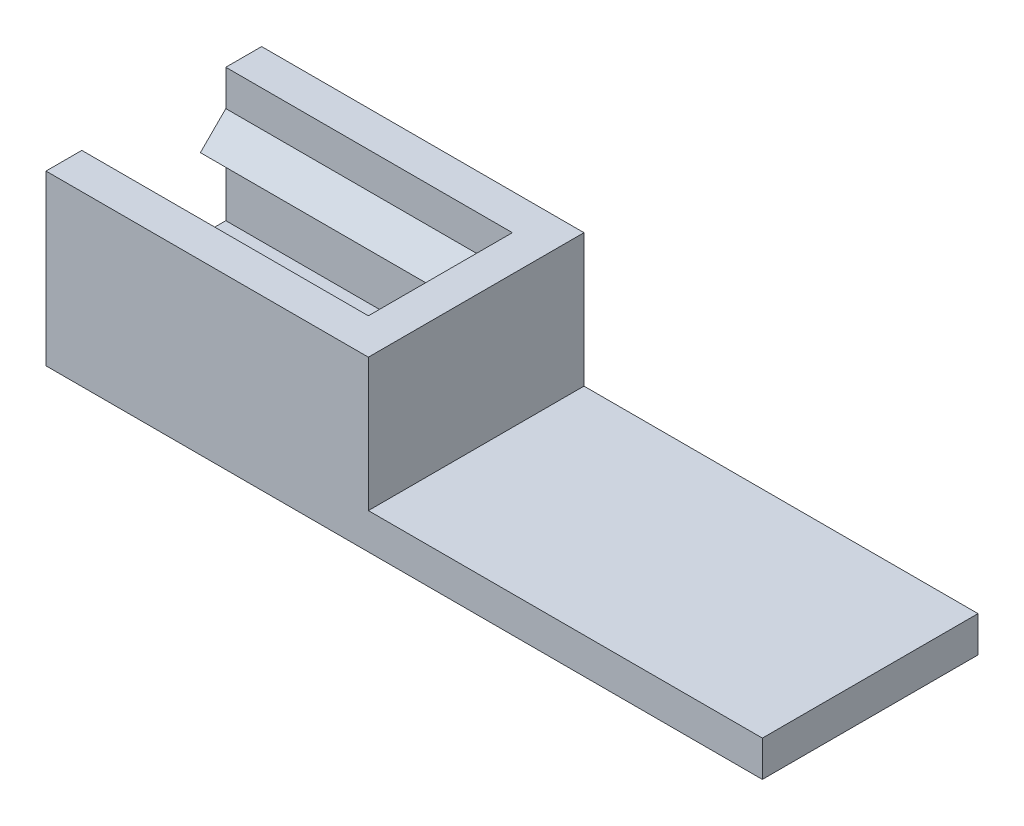
from build123d import *

# Parameters (mm, degrees)
BOSS_EXTRUDE1_DEPTH = 20
SKETCH3_W           = 30.1
SKETCH3_H           = 5
BOSS_EXTRUDE2_DEPTH = 60
SKETCH4_W           = 5
SKETCH4_H           = 30.1
BOSS_EXTRUDE3_DEPTH = 18.55


with BuildPart() as part:
    # Sketch2 → Boss-Extrude1 (new, symmetric)
    with BuildSketch(Plane(origin=(0, 0, 0), x_dir=(0, 0, -1), z_dir=(1, 0, 0))):
        Polygon((15.05, 0), (-15.05, 0), (-15.05, 23.55), (-10.05, 23.55), (-10.05, 18.55), (-6.5, 15), (-10.05, 11.45), (-10.05, 5), (10.05, 5), (10.05, 11.45), (6.5, 15), (10.05, 18.55), (10.05, 23.55), (15.05, 23.55), align=None)
    extrude(amount=BOSS_EXTRUDE1_DEPTH, both=True)

    # Sketch3 → Boss-Extrude2 (add)
    with BuildSketch(Plane(origin=(20, 0, 0), x_dir=(0, 0, -1), z_dir=(1, 0, 0))):
        with Locations((0, 2.5)):
            Rectangle(SKETCH3_W, SKETCH3_H)
    extrude(amount=BOSS_EXTRUDE2_DEPTH)

    # Sketch4 → Boss-Extrude3 (add)
    with BuildSketch(Plane(origin=(0, 5, 0), x_dir=(1, 0, 0), z_dir=(0, 1, 0))):
        with Locations((22.5, 0)):
            Rectangle(SKETCH4_W, SKETCH4_H)
    extrude(amount=BOSS_EXTRUDE3_DEPTH)


solid = part.part
